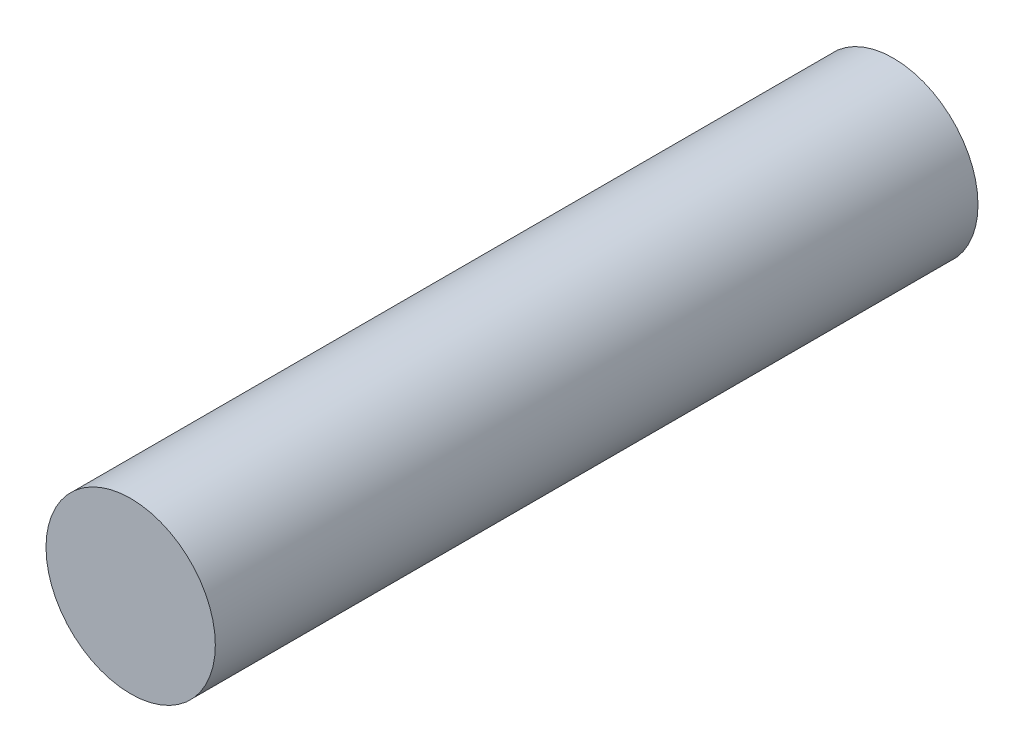
from build123d import *

# Parameters (mm, degrees)
SKETCH1_R           = 1.5875
BOSS_EXTRUDE1_DEPTH = 14.3002


with BuildPart() as part:
    # Sketch1 → Boss-Extrude1 (new body)
    with BuildSketch(Plane.XY):
        Circle(SKETCH1_R)
    extrude(amount=BOSS_EXTRUDE1_DEPTH)


solid = part.part
